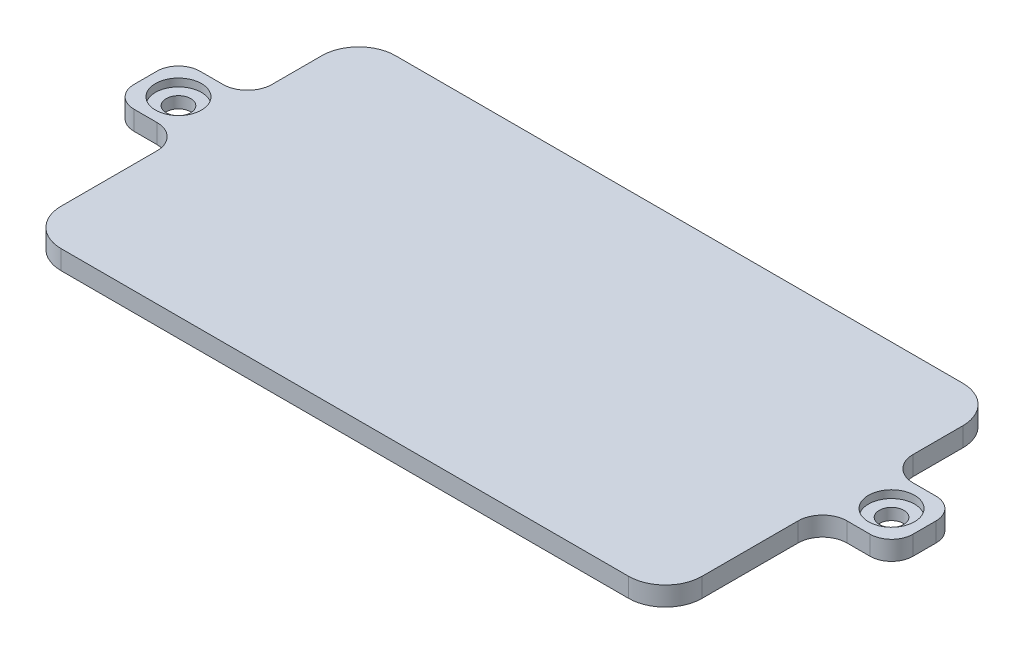
from build123d import *

# Parameters (mm, degrees)
EXTRUDE_1_DEPTH     = 2.5
SKETCH_2_R          = 1.6
CUT_EXTRUDE_1_DEPTH = 123.090022194
SKETCH_3_R          = 3
CUT_EXTRUDE_2_DEPTH = 1


with BuildPart() as part:
    # 草图1 → 凸台-拉伸1 (new body)
    with BuildSketch(Plane(origin=(0, 0, 0), x_dir=(1, 0, 0), z_dir=(0, 1, 0))):
        with BuildLine():
            Line((26.135435749, 0.2), (100.135435749, 0.2))
            ThreePointArc((100.135435749, 0.2), (103.529548299, 1.60588745), (104.935435749, 5))
            Line((104.935435749, 5), (104.935435749, 17.5))
            ThreePointArc((104.935435749, 17.5), (105.87269405, 19.7627417), (108.135435749, 20.7))
            Line((108.135435749, 20.7), (111.135435749, 20.7))
            ThreePointArc((111.135435749, 20.7), (113.115334737, 21.520101013), (113.935435749, 23.5))
            Line((113.935435749, 23.5), (113.935435749, 26.5))
            ThreePointArc((113.935435749, 26.5), (113.115334737, 28.479898987), (111.135435749, 29.3))
            Line((111.135435749, 29.3), (108.135435749, 29.3))
            ThreePointArc((108.135435749, 29.3), (105.87269405, 30.2372583), (104.935435749, 32.5))
            Line((104.935435749, 32.5), (104.935435749, 39))
            ThreePointArc((104.935435749, 39), (103.529548299, 42.39411255), (100.135435749, 43.8))
            Line((100.135435749, 43.8), (26.135435749, 43.8))
            ThreePointArc((26.135435749, 43.8), (22.7413232, 42.39411255), (21.335435749, 39))
            Line((21.335435749, 39), (21.335435749, 32.5))
            ThreePointArc((21.335435749, 32.5), (20.398177449, 30.2372583), (18.135435749, 29.3))
            Line((18.135435749, 29.3), (15.135435749, 29.3))
            ThreePointArc((15.135435749, 29.3), (13.155536762, 28.479898987), (12.335435749, 26.5))
            Line((12.335435749, 26.5), (12.335435749, 23.5))
            ThreePointArc((12.335435749, 23.5), (13.155536762, 21.520101013), (15.135435749, 20.7))
            Line((15.135435749, 20.7), (18.135435749, 20.7))
            ThreePointArc((18.135435749, 20.7), (20.398177449, 19.7627417), (21.335435749, 17.5))
            Line((21.335435749, 17.5), (21.335435749, 5))
            ThreePointArc((21.335435749, 5), (22.7413232, 1.60588745), (26.135435749, 0.2))
        make_face()
    extrude(amount=EXTRUDE_1_DEPTH)

    # 草图2 → 切除-拉伸1 (cut, through all)
    with BuildSketch(Plane(origin=(0, 2.5, 0), x_dir=(1, 0, 0), z_dir=(0, 1, 0))):
        with Locations(Location((16.635435749, 25, 0), (0, 0, 270))):
            Circle(SKETCH_2_R)
        with Locations(Location((109.635435749, 25, 0), (0, 0, 270))):
            Circle(SKETCH_2_R)
    extrude(amount=-CUT_EXTRUDE_1_DEPTH, mode=Mode.SUBTRACT)

    # 草图3 → 切除-拉伸2 (cut)
    with BuildSketch(Plane(origin=(0, 2.5, 0), x_dir=(1, 0, 0), z_dir=(0, 1, 0))):
        with Locations(Location((16.635435749, 25, 0), (0, 0, 270))):
            Circle(SKETCH_3_R)
        with Locations(Location((109.635435749, 25, 0), (0, 0, 270))):
            Circle(SKETCH_3_R)
    extrude(amount=-CUT_EXTRUDE_2_DEPTH, mode=Mode.SUBTRACT)


solid = part.part
